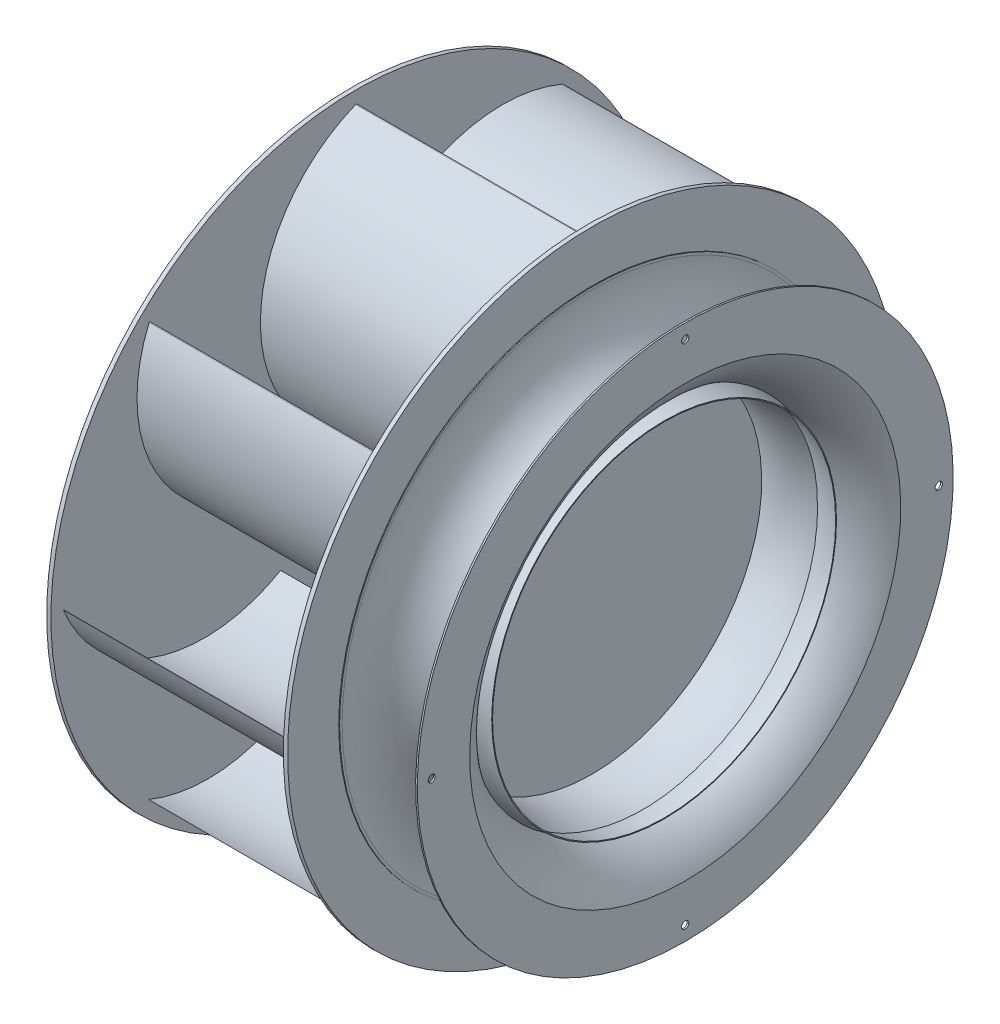
from build123d import *

# Parameters (mm, degrees)
SKETCH2_R         = 360.5
EXTRUDE1_DEPTH    = 5
SKETCH9_R         = 355.5
SKETCH9_R_2       = 100
EXTRUDE7_DEPTH    = 3
SKETCH3_R         = 360.5
EXTRUDE2_DEPTH    = 5
EXTRUDE3_DEPTH    = 280
CIRPATTERN1_COUNT = 8
SKETCH7_R         = 4.25
EXTRUDE5_DEPTH    = 5
CIRPATTERN2_COUNT = 4
SKETCH8_R         = 5
EXTRUDE6_DEPTH    = 90
CIRPATTERN3_COUNT = 8


with BuildPart() as part:
    # Sketch1 → Revolve1 (revolve)
    with BuildSketch(Plane.XY, mode=Mode.PRIVATE) as revolve1_sk:
        with BuildLine():
            Line((0, 0), (0, 109))
            ThreePointArc((0, 109), (1.464466094, 112.535533906), (5, 114))
            Line((5, 114), (70, 114))
            Line((70, 114), (70, 138))
            Line((70, 138), (90, 138))
            Line((90, 138), (90, 98))
            Line((90, 98), (92, 98))
            Line((92, 98), (92, 133))
            Line((92, 133), (95, 133))
            Line((95, 133), (95, 98))
            Line((95, 98), (97, 98))
            Line((97, 98), (97, 0))
            Line((97, 0), (0, 0))
        make_face()
    revolve(revolve1_sk.sketch.rotate(Axis((0, 0, 0), (1, 0, 0)), 90), axis=Axis((0, 0, 0), (1, 0, 0)))

    # Sketch2 → Extrude1 (add)
    with BuildSketch(Plane(origin=(97, 0, 0), x_dir=(0, 0, -1), z_dir=(1, 0, 0))):
        Circle(SKETCH2_R)
    extrude(amount=EXTRUDE1_DEPTH)

    # Sketch9 → Extrude7 (cut)
    with BuildSketch(Plane.ZY.offset(-97)):
        Circle(SKETCH9_R)
        Circle(SKETCH9_R_2, mode=Mode.SUBTRACT)
    extrude(amount=-EXTRUDE7_DEPTH, mode=Mode.SUBTRACT)



with BuildPart() as body_2:
    # Sketch3 → Extrude2 (new body)
    with BuildSketch(Plane(origin=(377, 0, 0), x_dir=(0, 0, -1), z_dir=(1, 0, 0))):
        Circle(SKETCH3_R)
    extrude(amount=EXTRUDE2_DEPTH)


with BuildPart() as part_1:
    add(part.part)

    add(body_2.part)  # Extrude3 merges body 2
    # Sketch4 → Extrude3 (add)
    with BuildSketch(Plane(origin=(102, 0, 0), x_dir=(0, 0, -1), z_dir=(1, 0, 0))):
        with BuildLine():
            Line((0, 125), (0.866025404, 124.5))
            ThreePointArc((0.866025404, 124.5), (95.805210607, 239.87865649), (245.171418304, 243.8053929))
            Line((245.171418304, 243.8053929), (244.3053929, 244.3053929))
            ThreePointArc((244.3053929, 244.3053929), (94.939185203, 240.37865649), (0, 125))
        make_face()
    extrude3 = extrude(amount=EXTRUDE3_DEPTH)

    # CirPattern1: Extrude3 ×8 about axis
    cirpattern1_axis = Axis((0, 0, 0), (1, 0, 0))
    for i in range(1, CIRPATTERN1_COUNT):
        add(extrude3.rotate(cirpattern1_axis, i * 360 / CIRPATTERN1_COUNT))

    # Sketch5 → Revolve2 (revolve)
    with BuildSketch(Plane.XY, mode=Mode.PRIVATE) as revolve2_sk:
        with BuildLine():
            Line((382, 300), (383, 300))
            Line((383, 300), (383, 297))
            ThreePointArc((383, 297), (404.543751848, 232.023388766), (467, 204))
            Line((467, 204), (467, 203))
            ThreePointArc((467, 203), (403.475614999, 230.988588031), (382, 297))
            Line((382, 297), (382, 300))
        make_face()
    revolve(revolve2_sk.sketch.rotate(Axis((0, 0, 0), (1, 0, 0)), 90), axis=Axis((0, 0, 0), (1, 0, 0)))

    # Sketch8 → Extrude6 (cut)
    with BuildSketch(Plane(origin=(0, 0, 0), x_dir=(0, 0, -1), z_dir=(1, 0, 0))):
        with Locations(Location((0, 126, 0), (0, 0, 180))):
            Circle(SKETCH8_R)
    extrude6 = extrude(amount=EXTRUDE6_DEPTH, mode=Mode.SUBTRACT)

    # CirPattern3: Extrude6 ×8 about axis
    cirpattern3_axis = Axis((0, 0, 0), (1, 0, 0))
    for i in range(1, CIRPATTERN3_COUNT):
        add(extrude6.rotate(cirpattern3_axis, i * 360 / CIRPATTERN3_COUNT), mode=Mode.SUBTRACT)


with BuildPart() as body_2_2:
    # Sketch6 → Revolve3 (revolve)
    with BuildSketch(Plane.XY, mode=Mode.PRIVATE) as revolve3_sk:
        with BuildLine():
            Line((492, 317), (490, 317))
            Line((490, 317), (490, 255))
            ThreePointArc((490, 255), (443.401338972, 209.999064886), (379, 203))
            Line((379, 203), (375, 203))
            Line((375, 203), (375, 201))
            Line((375, 201), (379, 201))
            ThreePointArc((379, 201), (445.000318465, 208.119703952), (492, 255))
            Line((492, 255), (492, 317))
        make_face()
    revolve(revolve3_sk.sketch.rotate(Axis((0, 0, 0), (1, 0, 0)), 180), axis=Axis((0, 0, 0), (1, 0, 0)))

    # Sketch7 → Extrude5 (cut)
    with BuildSketch(Plane(origin=(492, 0, 0), x_dir=(0, 0, -1), z_dir=(1, 0, 0))):
        with Locations((0, 300)):
            Circle(SKETCH7_R)
    extrude5 = extrude(amount=-EXTRUDE5_DEPTH, mode=Mode.SUBTRACT)

    # CirPattern2: Extrude5 ×4 about axis
    cirpattern2_axis = Axis((0, 0, 0), (1, 0, 0))
    for i in range(1, CIRPATTERN2_COUNT):
        add(extrude5.rotate(cirpattern2_axis, i * 360 / CIRPATTERN2_COUNT), mode=Mode.SUBTRACT)


solid = Compound([part_1.part, body_2_2.part])
